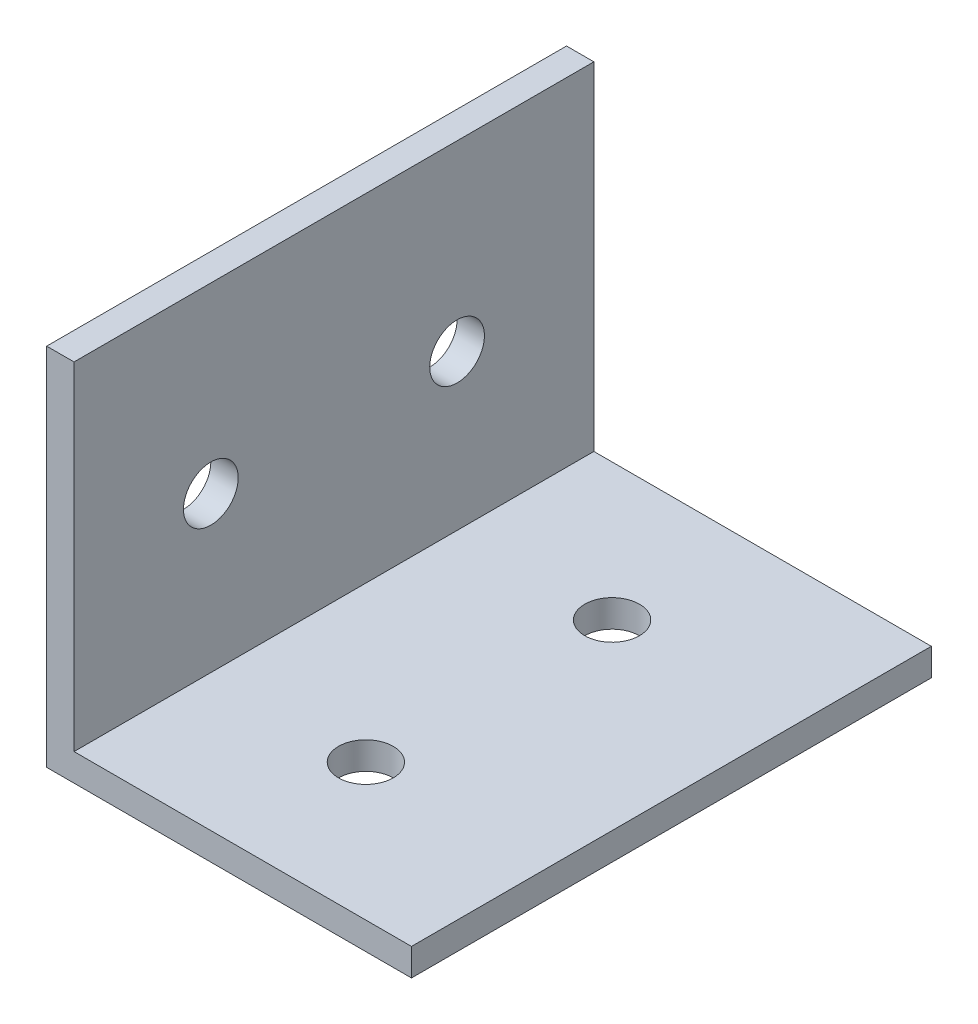
from build123d import *

# Parameters (mm, degrees)
EXTRUSION1_DEPTH = 28.5
ESQUISSE2_R      = 1.5
EXTRUSION2_DEPTH = 47.5
ESQUISSE3_R      = 1.5
EXTRUSION3_DEPTH = 10


with BuildPart() as part:
    # Esquisse1 → Extrusion1 (new body)
    with BuildSketch(Plane.XY):
        Polygon((-16.977160064, 3.864315789), (-16.977160064, -16.135684211), (3.022839936, -16.135684211), (3.022839936, -14.635684211), (-15.477160064, -14.635684211), (-15.477160064, 3.864315789), align=None)
    extrude(amount=EXTRUSION1_DEPTH)

    # Esquisse2 → Extrusion2 (cut)
    with BuildSketch(Plane.ZY.offset(16.977160064)):
        with Locations(Location((21, -6.135684211, 0), (0, 0, 270))):
            Circle(ESQUISSE2_R)
        with Locations(Location((7.5, -6.135684211, 0), (0, 0, 270))):
            Circle(ESQUISSE2_R)
    extrude(amount=-EXTRUSION2_DEPTH, mode=Mode.SUBTRACT)

    # Esquisse3 → Extrusion3 (cut)
    with BuildSketch(Plane.XZ.offset(16.135684211)):
        with Locations(Location((-6.977160064, 7.5, 0), (0, 0, 270))):
            Circle(ESQUISSE3_R)
        with Locations(Location((-6.977160064, 21, 0), (0, 0, 270))):
            Circle(ESQUISSE3_R)
    extrude(amount=-EXTRUSION3_DEPTH, mode=Mode.SUBTRACT)


solid = part.part
